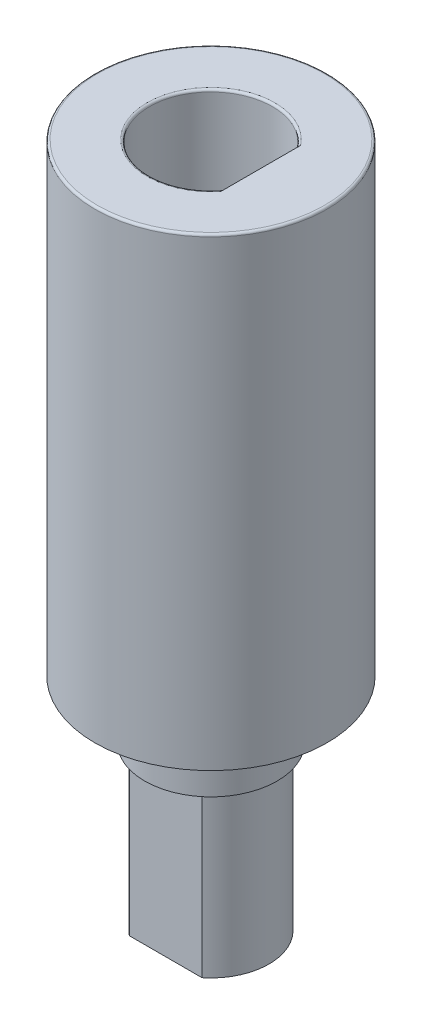
from build123d import *

# Parameters (mm, degrees)
SKETCH2_R           = 5
BOSS_EXTRUDE1_DEPTH = 20
CUT_EXTRUDE3_DEPTH  = 15
BOSS_EXTRUDE2_DEPTH = 9.5
SKETCH6_R           = 2.85
BOSS_EXTRUDE3_DEPTH = 2.5
FILLET3_R           = 0.1


with BuildPart() as part:
    # Sketch2 → Boss-Extrude1 (new body)
    with BuildSketch(Plane(origin=(0, 0, 0), x_dir=(1, 0, 0), z_dir=(0, 1, 0))):
        with Locations(Location((0, 0, 0), (0, 0, 270))):
            Circle(SKETCH2_R)
    extrude(amount=BOSS_EXTRUDE1_DEPTH)

    # Sketch3 → Cut-Extrude3 (cut)
    with BuildSketch(Plane(origin=(0, 20, 0), x_dir=(1, 0, 0), z_dir=(0, 1, 0))):
        with BuildLine():
            Line((2.15, 1.549193338), (2.15, -1.549193338))
            ThreePointArc((2.15, -1.549193338), (-2.65, 0), (2.15, 1.549193338))
        make_face()
    extrude(amount=-CUT_EXTRUDE3_DEPTH, mode=Mode.SUBTRACT)

    # Sketch4 → Boss-Extrude2 (add)
    with BuildSketch(Plane(origin=(0, 0, 0), x_dir=(-1, 0, 0), z_dir=(0, -1, 0))):
        with BuildLine():
            Line((1.564448785, 1.95), (-1.564448785, 1.95))
            ThreePointArc((-1.564448785, 1.95), (-2.5, 0), (-1.564448785, -1.95))
            Line((-1.564448785, -1.95), (1.564448785, -1.95))
            ThreePointArc((1.564448785, -1.95), (2.5, 0), (1.564448785, 1.95))
        make_face()
    extrude(amount=BOSS_EXTRUDE2_DEPTH)

    # Sketch6 → Boss-Extrude3 (add)
    with BuildSketch(Plane.XZ):
        with Locations(Location((0, 0, 0), (0, 0, 90))):
            Circle(SKETCH6_R)
    extrude(amount=BOSS_EXTRUDE3_DEPTH)

    # Fillet3
    fillet3_edges = [part.edges().sort_by_distance(p)[0] for p in [
        (0, 20, -5),
        (-2.65, 20, 0),
    ]]
    fillet(fillet3_edges, radius=FILLET3_R)


solid = part.part
